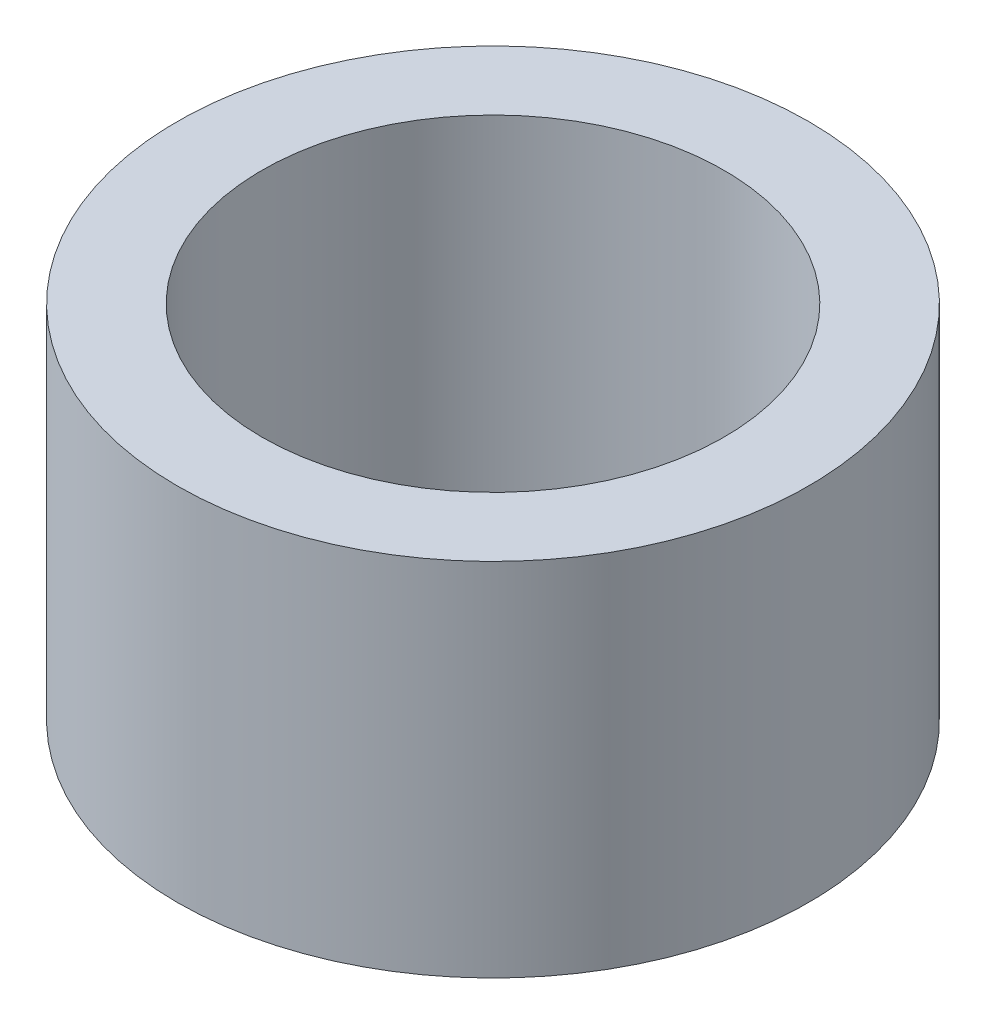
from build123d import *

# Parameters (mm, degrees)
SKIZZE1_R                       = 5.6
SKIZZE1_R_2                     = 4.1
AUFSATZ_LINEAR_AUSTRAGEN1_DEPTH = 6.4


with BuildPart() as part:
    # Skizze1 → Aufsatz-Linear austragen1 (new body)
    with BuildSketch(Plane(origin=(0, 0, 0), x_dir=(1, 0, 0), z_dir=(0, 1, 0))):
        with Locations(Location((0, 0, 0), (0, 0, 270))):
            Circle(SKIZZE1_R)
        with Locations(Location((0, 0, 0), (0, 0, 270))):
            Circle(SKIZZE1_R_2, mode=Mode.SUBTRACT)
    extrude(amount=AUFSATZ_LINEAR_AUSTRAGEN1_DEPTH)


solid = part.part
